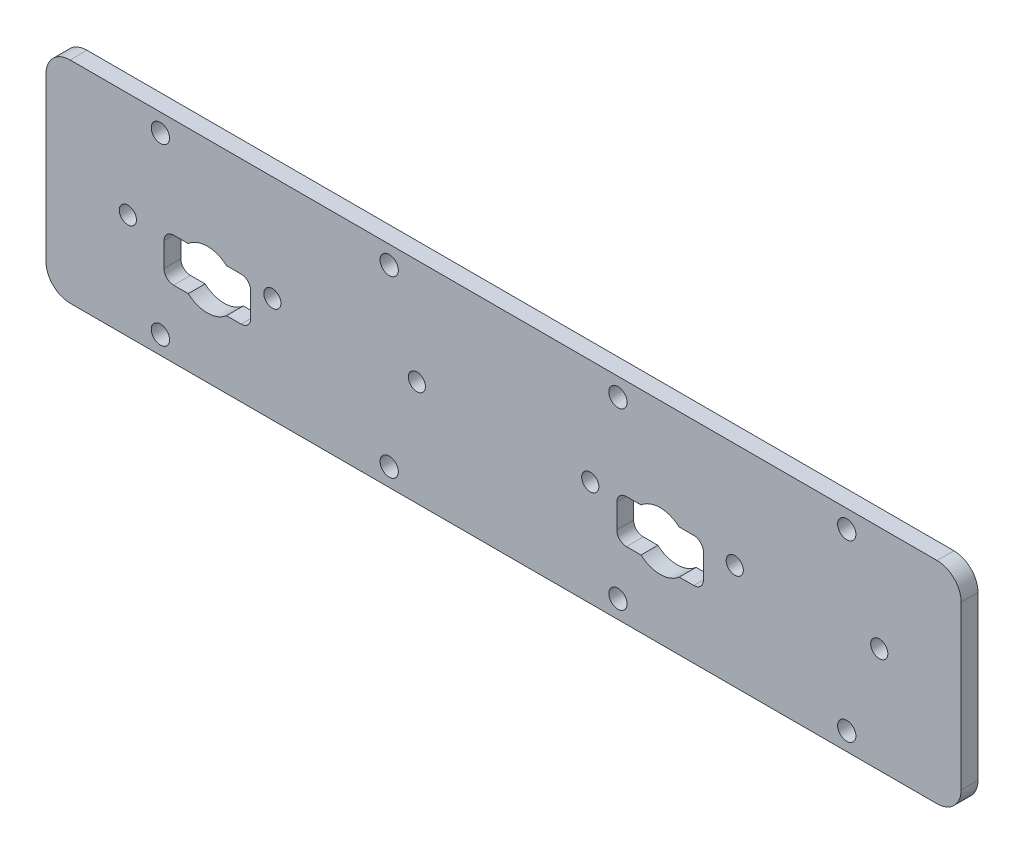
from build123d import *

# Parameters (mm, degrees)
SKETCH1_W             = 190
SKETCH1_H             = 43.75
BOSS_EXTRUDE1_DEPTH   = 3.5
F_6_CLEARANCE_HOLE1_D = 3.7973
CUT_EXTRUDE1_DEPTH    = 98.548785871
FILLET1_R             = 2
FILLET2_R             = 5
F_6_CLEARANCE_HOLE2_D = 3.556


with BuildPart() as part:
    # Sketch1 → Boss-Extrude1 (new body)
    with BuildSketch(Plane.XY.offset(32)):
        Rectangle(SKETCH1_W, SKETCH1_H)
    extrude(amount=BOSS_EXTRUDE1_DEPTH)

    # #6 Clearance Hole1 (through all)
    with Locations(Plane.XY.offset(35.5)):
        with Locations((71.25, 18.125), (23.75, 18.125), (-23.75, 18.125), (-71.25, 18.125), (-71.25, -18.125), (-23.75, -18.125), (23.75, -18.125), (71.25, -18.125)):
            Hole(F_6_CLEARANCE_HOLE1_D / 2)

    # Sketch6 → Cut-Extrude1 (cut, through all)
    with BuildSketch(Plane.XY.offset(35.5)):
        with BuildLine():
            Line((36.468626967, -7.875), (41.5, -7.875))
            Line((41.5, -7.875), (41.5, 1.125))
            Line((41.5, 1.125), (36.468626967, 1.125))
            ThreePointArc((36.468626967, 1.125), (32.5, 2.625), (28.531373033, 1.125))
            Line((28.531373033, 1.125), (23.5, 1.125))
            Line((23.5, 1.125), (23.5, -7.875))
            Line((23.5, -7.875), (28.531373033, -7.875))
            ThreePointArc((28.531373033, -7.875), (32.5, -9.375), (36.468626967, -7.875))
        make_face()
        with BuildLine():
            Line((-70.5, 1.125), (-70.5, -7.875))
            Line((-70.5, -7.875), (-65.468626967, -7.875))
            ThreePointArc((-65.468626967, -7.875), (-61.5, -9.375), (-57.531373033, -7.875))
            Line((-57.531373033, -7.875), (-52.5, -7.875))
            Line((-52.5, -7.875), (-52.5, 1.125))
            Line((-52.5, 1.125), (-57.531373033, 1.125))
            ThreePointArc((-57.531373033, 1.125), (-61.5, 2.625), (-65.468626967, 1.125))
            Line((-65.468626967, 1.125), (-70.5, 1.125))
        make_face()
    extrude(amount=-CUT_EXTRUDE1_DEPTH, mode=Mode.SUBTRACT)

    # Fillet1
    fillet1_edges = [part.edges().sort_by_distance(p)[0] for p in [
        (41.5, 1.125, 33.75),
        (41.5, -7.875, 33.75),
        (23.5, -7.875, 33.75),
        (23.5, 1.125, 33.75),
        (-52.5, 1.125, 33.75),
        (-52.5, -7.875, 33.75),
        (-70.5, -7.875, 33.75),
        (-70.5, 1.125, 33.75),
    ]]
    fillet(fillet1_edges, radius=FILLET1_R)

    # Fillet2
    fillet2_edges = [part.edges().sort_by_distance(p)[0] for p in [
        (95, -21.875, 33.75),
        (-95, -21.875, 33.75),
        (-95, 21.875, 33.75),
        (95, 21.875, 33.75),
    ]]
    fillet(fillet2_edges, radius=FILLET2_R)

    # #6 Clearance Hole2 (through all)
    with Locations(Plane.XY.offset(35.5)):
        with Locations((78, 0), (48, 0), (18, 0), (-18, 0), (-48, 0), (-78, 0)):
            Hole(F_6_CLEARANCE_HOLE2_D / 2)


solid = part.part
